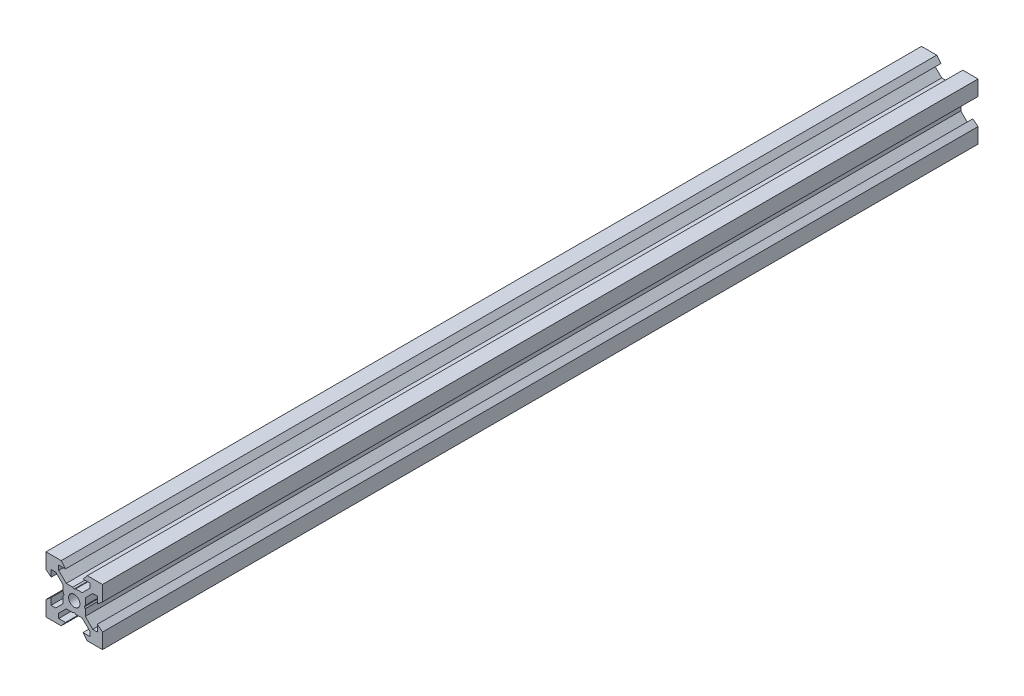
from build123d import *

# Parameters (mm, degrees)
SKETCH1_R           = 2
BOSS_EXTRUDE1_DEPTH = 155


with BuildPart() as part:
    # Sketch1 → Boss-Extrude1 (new, symmetric)
    with BuildSketch(Plane.XY):
        Polygon((10, 10), (10, 4.610379336), (8.2, 3.1), (8.2, 5.5), (6.560660172, 5.5), (3.9, 2.839339828), (3.9, 0.519615242), (3.6, 0), (3.9, -0.519615242), (3.9, -2.839339828), (6.560660172, -5.5), (8.2, -5.5), (8.2, -3.1), (10, -4.610379336), (10, -10), (4.610379336, -10), (3.1, -8.2), (5.5, -8.2), (5.5, -6.560660172), (2.839339828, -3.9), (0.519615242, -3.9), (0, -3.6), (-0.519615242, -3.9), (-2.839339828, -3.9), (-5.5, -6.560660172), (-5.5, -8.2), (-3.1, -8.2), (-4.610379336, -10), (-10, -10), (-10, -4.610379336), (-8.2, -3.1), (-8.2, -5.5), (-6.560660172, -5.5), (-3.9, -2.839339828), (-3.9, -0.519615242), (-3.6, 0), (-3.9, 0.519615242), (-3.9, 2.839339828), (-6.560660172, 5.5), (-8.2, 5.5), (-8.2, 3.1), (-10, 4.610379336), (-10, 10), (-4.610379336, 10), (-3.1, 8.2), (-5.5, 8.2), (-5.5, 6.560660172), (-2.839339828, 3.9), (-0.519615242, 3.9), (0, 3.6), (0.519615242, 3.9), (2.839339828, 3.9), (5.5, 6.560660172), (5.5, 8.2), (3.1, 8.2), (4.610379336, 10), align=None)
        Circle(SKETCH1_R, mode=Mode.SUBTRACT)
    extrude(amount=BOSS_EXTRUDE1_DEPTH, both=True)


solid = part.part
